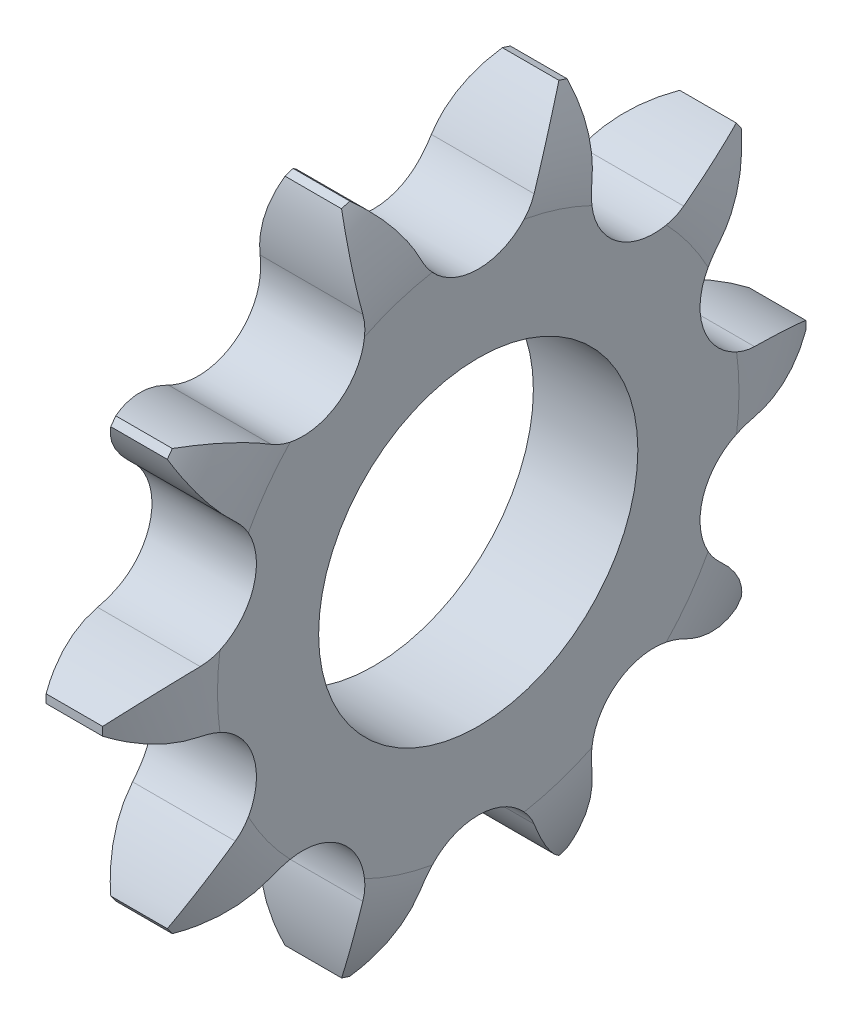
from build123d import *

# Parameters (mm, degrees)
TOOTHCUT_DEPTH  = 36.016771055
TEETHCUTS_COUNT = 10
TEETHCUTS_ANGLE = 324
BORSKE_R        = 11
BORE_DEPTH      = 50.0005


with BuildPart() as part:
    # BasProSke → Base-Revolve (revolve)
    with BuildSketch(Plane(origin=(0, 0, 0), x_dir=(1, 0, 0), z_dir=(0, 1, 0)), mode=Mode.PRIVATE) as base_revolve_sk:
        with BuildLine():
            Line((0, 0), (0, 17.969774818))
            ThreePointArc((0, 17.969774818), (0.41968445, 21.207652209), (1.651, 24.23153168))
            Line((1.651, 24.23153168), (5.549, 24.23153168))
            ThreePointArc((5.549, 24.23153168), (6.78031555, 21.207652209), (7.2, 17.969774818))
            Line((7.2, 17.969774818), (7.2, 0))
            Line((7.2, 0), (0, 0))
        make_face()
    revolve(base_revolve_sk.sketch.rotate(Axis((-10, 0, 0), (1, 0, 0)), 180), axis=Axis((-10, 0, 0), (1, 0, 0)))

    # TooCutSke → ToothCut (cut, through all)
    with BuildSketch(Plane(origin=(0, 0, 0), x_dir=(0, 0, -1), z_dir=(1, 0, 0))):
        with BuildLine():
            ThreePointArc((3.91060406, 18.809416735), (5.501807162, 21.3944141), (7.679581337, 23.508991678))
            ThreePointArc((7.679581337, 23.508991678), (0, 24.73153168), (-7.679581337, 23.508991678))
            ThreePointArc((-7.679581337, 23.508991678), (-5.501807162, 21.3944141), (-3.91060406, 18.809416735))
            ThreePointArc((-3.91060406, 18.809416735), (0, 16.29403168), (3.91060406, 18.809416735))
        make_face()
    toothcut = extrude(amount=TOOTHCUT_DEPTH, mode=Mode.SUBTRACT)

    # TeethCuts: ToothCut ×10 about axis
    teethcuts_axis = Axis((-10, 0, 0), (1, 0, 0))
    for i in range(1, TEETHCUTS_COUNT):
        add(toothcut.rotate(teethcuts_axis, i * TEETHCUTS_ANGLE / (TEETHCUTS_COUNT - 1)), mode=Mode.SUBTRACT)

    # BorSke → Bore (cut, symmetric)
    with BuildSketch(Plane(origin=(0, 0, 0), x_dir=(0, 0, -1), z_dir=(1, 0, 0))):
        with Locations(Location((0, 0, 0), (0, 0, 180))):
            Circle(BORSKE_R)
    extrude(amount=BORE_DEPTH, both=True, mode=Mode.SUBTRACT)


solid = part.part
